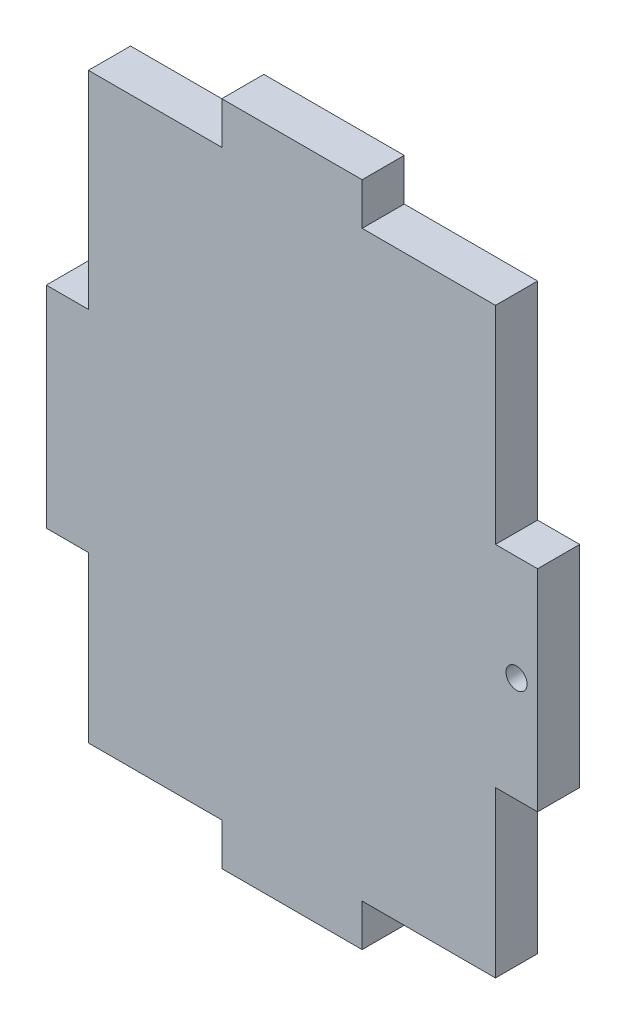
from build123d import *

# Parameters (mm, degrees)
ESQUISSE1_W             = 70
ESQUISSE1_H             = 95
BOSS_EXTRU_1_DEPTH      = 6
ENL_V_MAT_EXTRU_1_DEPTH = 119.156675647
ESQUISSE3_R             = 1.5
ENL_V_MAT_EXTRU_2_DEPTH = 119.156675647
ESQUISSE4_R             = 2.995
ENL_V_MAT_EXTRU_3_DEPTH = 3


with BuildPart() as part:
    # Esquisse1 → Boss.-Extru.1 (new body)
    with BuildSketch(Plane.XY):
        with Locations((-35, 47.5)):
            Rectangle(ESQUISSE1_W, ESQUISSE1_H)
    extrude(amount=BOSS_EXTRU_1_DEPTH)

    # Esquisse2 → Enlèv. mat.-Extru.1 (cut, through all)
    with BuildSketch(Plane(origin=(0, 0, 0), x_dir=(-1, 0, 0), z_dir=(0, 0, -1))):
        Polygon((0, 95), (25, 95), (25, 89), (6, 89), (6, 59.5), (0, 59.5), align=None)
        Polygon((70, 95), (45, 95), (45, 89), (64, 89), (64, 59.5), (70, 59.5), align=None)
        Polygon((0, 0), (25, 0), (25, 6), (6, 6), (6, 29.5), (0, 29.5), align=None)
        Polygon((45, 0), (70, 0), (70, 29.5), (64, 29.5), (64, 6), (45, 6), align=None)
    extrude(amount=-ENL_V_MAT_EXTRU_1_DEPTH, mode=Mode.SUBTRACT)

    # Esquisse3 → Enlèv. mat.-Extru.2 (cut, through all)
    with BuildSketch(Plane(origin=(0, 0, 0), x_dir=(-1, 0, 0), z_dir=(0, 0, -1))):
        with Locations((3, 44.5)):
            Circle(ESQUISSE3_R)
    extrude(amount=-ENL_V_MAT_EXTRU_2_DEPTH, mode=Mode.SUBTRACT)

    # Esquisse4 → Enlèv. mat.-Extru.3 (cut)
    with BuildSketch(Plane(origin=(0, 0, 0), x_dir=(-1, 0, 0), z_dir=(0, 0, -1))):
        with Locations((3, 44.5)):
            Circle(ESQUISSE4_R)
    extrude(amount=-ENL_V_MAT_EXTRU_3_DEPTH, mode=Mode.SUBTRACT)


solid = part.part
